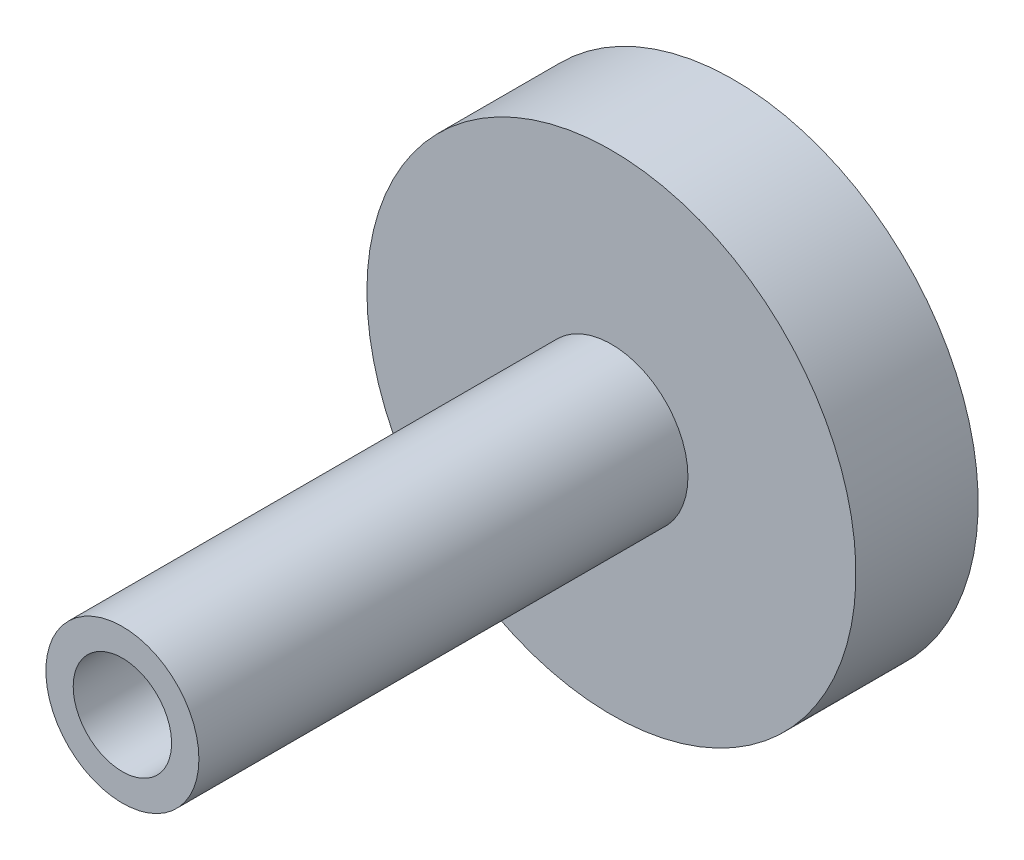
from build123d import *

# Parameters (mm, degrees)
SKETCH1_R           = 12.7
SKETCH1_R_2         = 2.555
BOSS_EXTRUDE1_DEPTH = 31.75
CUT_EXTRUDE1_START  = -25.4
SKETCH2_R           = 12.7
SKETCH2_R_2         = 3.9751
CUT_EXTRUDE1_DEPTH  = 25.4


with BuildPart() as part:
    # Sketch1 → Boss-Extrude1 (new body)
    with BuildSketch(Plane.XY):
        Circle(SKETCH1_R)
        Circle(SKETCH1_R_2, mode=Mode.SUBTRACT)
    extrude(amount=BOSS_EXTRUDE1_DEPTH)

    # Sketch2 → Cut-Extrude1 (cut)
    with BuildSketch(Plane.XY.offset(31.75).offset(CUT_EXTRUDE1_START)):
        with Locations(Location((0, 0, 0), (0, 0, 180))):
            Circle(SKETCH2_R)
        Circle(SKETCH2_R_2, mode=Mode.SUBTRACT)
    extrude(amount=CUT_EXTRUDE1_DEPTH, mode=Mode.SUBTRACT)


solid = part.part
